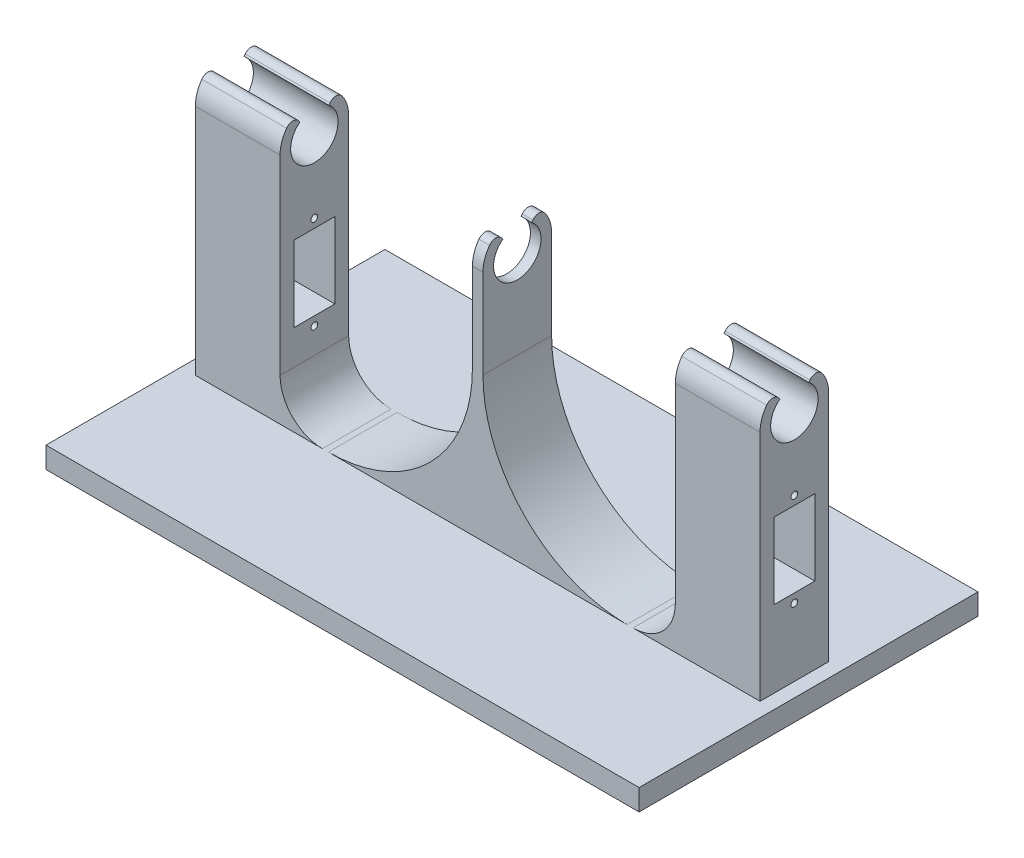
from build123d import *

# Parameters (mm, degrees)
SKETCH1_W           = 177.8
SKETCH1_H           = 101.6
BOSS_EXTRUDE1_DEPTH = 6.35
BOSS_EXTRUDE2_DEPTH = 177.8
SKETCH3_W           = 57.658
SKETCH3_H           = 101.6
SKETCH3_W_2         = 4.2545
CUT_EXTRUDE1_DEPTH  = 129.722963579
FILLET1_R           = 43.18
FILLET2_R           = 12.7
FILLET3_R           = 2.286
SKETCH5_R           = 1
SKETCH5_W           = 12.3
SKETCH5_H           = 22.7
CUT_EXTRUDE2_DEPTH  = 178.330785165
CUT_EXTRUDE3_START  = 118.491
SKETCH5_2_R         = 1
SKETCH5_2_W         = 12.3
SKETCH5_2_H         = 22.7
CUT_EXTRUDE3_DEPTH  = 59.839785165


with BuildPart() as part:
    # Sketch1 → Boss-Extrude1 (new body)
    with BuildSketch(Plane(origin=(0, 0, 0), x_dir=(1, 0, 0), z_dir=(0, 1, 0))):
        Rectangle(SKETCH1_W, SKETCH1_H)
    extrude(amount=BOSS_EXTRUDE1_DEPTH)

    # Sketch2 → Boss-Extrude2 (add)
    with BuildSketch(Plane.ZY.offset(88.9)):
        with BuildLine():
            Line((0, 69.088), (0, 6.35))
            Line((0, 6.35), (10.287, 6.35))
            Line((10.287, 6.35), (10.287, 76.2))
            ThreePointArc((10.287, 76.2), (9.226129892, 80.749823756), (6.26232882, 84.361225812))
            Line((6.26232882, 84.361225812), (4.329511283, 81.842328956))
            ThreePointArc((4.329511283, 81.842328956), (6.734567081, 73.913922523), (0, 69.088))
        make_face()
        with BuildLine():
            Line((-10.287, 76.2), (-10.287, 6.35))
            Line((-10.287, 6.35), (0, 6.35))
            Line((0, 6.35), (0, 69.088))
            ThreePointArc((0, 69.088), (-6.734567081, 73.913922523), (-4.329511283, 81.842328956))
            Line((-4.329511283, 81.842328956), (-6.26232882, 84.361225812))
            ThreePointArc((-6.26232882, 84.361225812), (-9.226129892, 80.749823756), (-10.287, 76.2))
        make_face()
    extrude(amount=-BOSS_EXTRUDE2_DEPTH)

    # Sketch3 → Cut-Extrude1 (cut, through all)
    with BuildSketch(Plane(origin=(0, 6.35, 0), x_dir=(1, 0, 0), z_dir=(0, 1, 0))):
        with Locations((-30.4165, 0)):
            Rectangle(SKETCH3_W, SKETCH3_H)
        with Locations((30.4165, 0)):
            Rectangle(SKETCH3_W, SKETCH3_H)
        with Locations((86.77275, 0)):
            Rectangle(SKETCH3_W_2, SKETCH3_H)
        with Locations((-86.77275, 0)):
            Rectangle(SKETCH3_W_2, SKETCH3_H)
    extrude(amount=CUT_EXTRUDE1_DEPTH, mode=Mode.SUBTRACT)

    # Fillet1
    fillet1_edges = [part.edges().sort_by_distance(p)[0] for p in [
        (1.5875, 6.35, 0),
        (-1.5875, 6.35, 0),
    ]]
    fillet(fillet1_edges, radius=FILLET1_R)

    # Fillet2
    fillet2_edges = [part.edges().sort_by_distance(p)[0] for p in [
        (59.2455, 6.35, 0),
        (-59.2455, 6.35, 0),
    ]]
    fillet(fillet2_edges, radius=FILLET2_R)

    # Fillet3
    fillet3_edges = [part.edges().sort_by_distance(p)[0] for p in [
        (71.9455, 84.361225812, -6.26232882),
        (0, 84.361225812, -6.26232882),
        (-71.9455, 84.361225812, -6.26232882),
        (71.9455, 84.361225812, 6.26232882),
        (0, 84.361225812, 6.26232882),
        (-71.9455, 84.361225812, 6.26232882),
    ]]
    fillet(fillet3_edges, radius=FILLET3_R)

    # Sketch5 → Cut-Extrude2 (cut, through all)
    with BuildSketch(Plane.ZY.offset(-59.2455)):
        with Locations((0, 54.7)):
            Circle(SKETCH5_R)
        with Locations((0, 26.7)):
            Circle(SKETCH5_R)
        with Locations((0, 40.7)):
            Rectangle(SKETCH5_W, SKETCH5_H)
    extrude(amount=-CUT_EXTRUDE2_DEPTH, mode=Mode.SUBTRACT)

    # Sketch5<2> → Cut-Extrude3 (cut, through all)
    with BuildSketch(Plane.ZY.offset(-59.2455).offset(CUT_EXTRUDE3_START)):
        with Locations((0, 54.7)):
            Circle(SKETCH5_2_R)
        with Locations((0, 26.7)):
            Circle(SKETCH5_2_R)
        with Locations((0, 40.7)):
            Rectangle(SKETCH5_2_W, SKETCH5_2_H)
    extrude(amount=CUT_EXTRUDE3_DEPTH, mode=Mode.SUBTRACT)


solid = part.part
